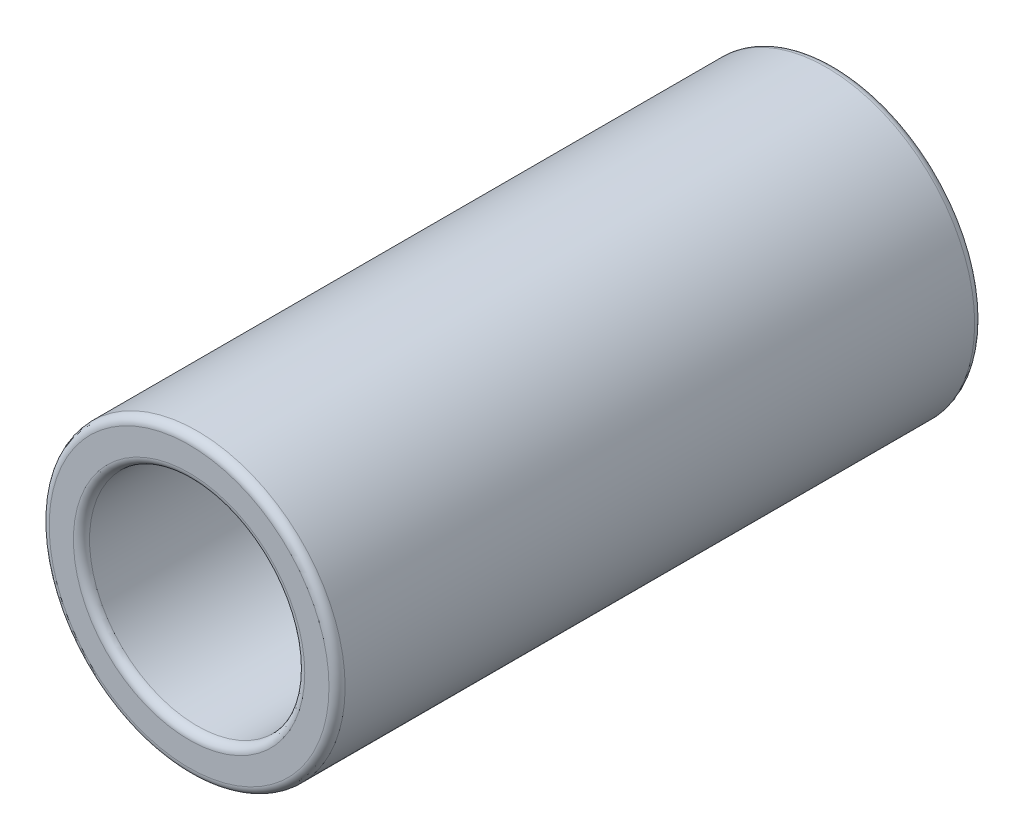
from build123d import *

# Parameters (mm, degrees)
CROQUIS1_R              = 5.5
CROQUIS1_R_2            = 4
SALIENTE_EXTRUIR1_DEPTH = 24
REDONDEO1_R             = 0.3


with BuildPart() as part:
    # Croquis1 → Saliente-Extruir1 (new body)
    with BuildSketch(Plane.XY):
        Circle(CROQUIS1_R)
        Circle(CROQUIS1_R_2, mode=Mode.SUBTRACT)
    extrude(amount=SALIENTE_EXTRUIR1_DEPTH)

    # Redondeo1
    redondeo1_edges = [part.edges().sort_by_distance(p)[0] for p in [
        (-5.5, 0, 0),
        (-5.5, 0, 24),
        (-4, 0, 0),
        (-4, 0, 24),
    ]]
    fillet(redondeo1_edges, radius=REDONDEO1_R)


solid = part.part
